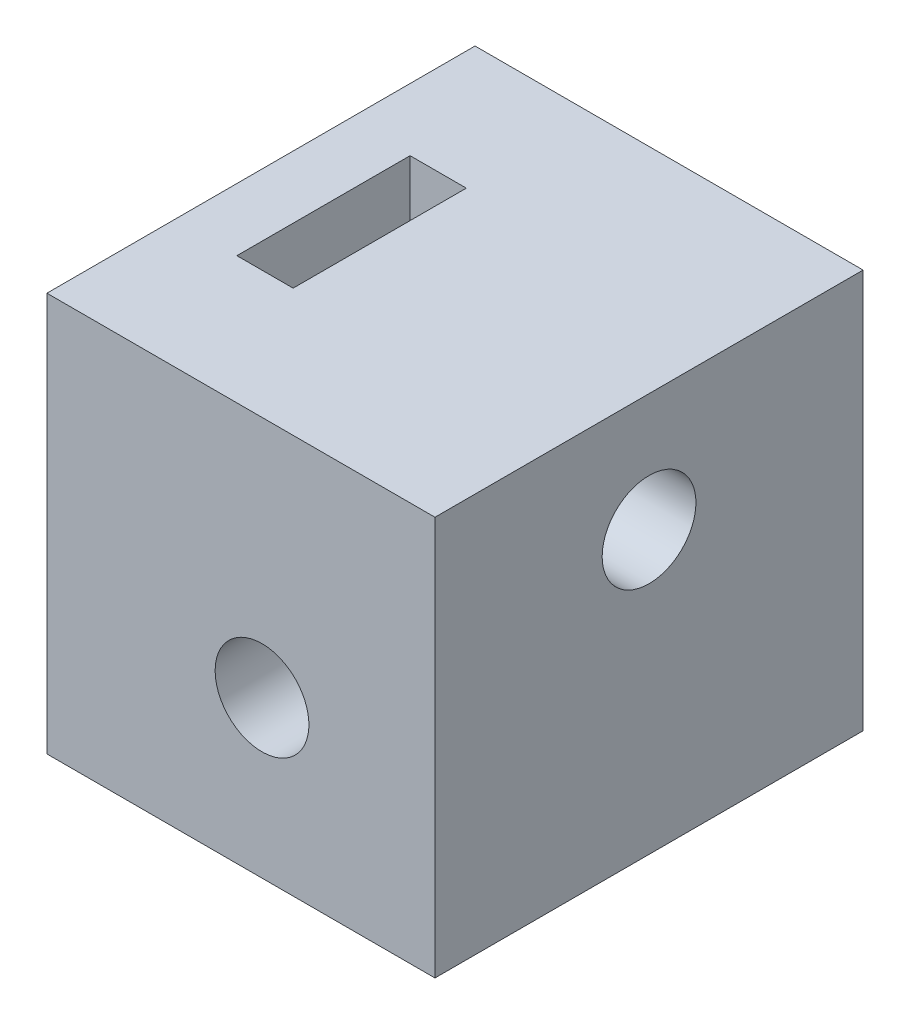
from build123d import *

# Parameters (mm, degrees)
SKETCH1_W           = 12.41763252
SKETCH1_H           = 12.769068876
SKETCH1_R           = 1.5
BOSS_EXTRUDE1_DEPTH = 13.7
SKETCH2_R           = 1.5
CUT_EXTRUDE1_DEPTH  = 23.47079699
CUT_EXTRUDE2_DEPTH  = 1.8
SKETCH5_W           = 1.8
SKETCH5_H           = 5.542562584
CUT_EXTRUDE4_DEPTH  = 3.769069
SKETCH6_W           = 1.8
SKETCH6_H           = 2.771281292
CUT_EXTRUDE5_DEPTH  = 17.740669043


with BuildPart() as part:
    # Sketch1 → Boss-Extrude1 (new body)
    # profile 1 of 2: a face of its own
    with BuildSketch(Plane.XY):
        with Locations((0.79118374, 6.384534438)):
            Rectangle(SKETCH1_W, SKETCH1_H)
        with Locations(Location((1.465537563, 5, 0), (0, 0, 180))):
            Circle(SKETCH1_R, mode=Mode.SUBTRACT)
        with Locations((1.465537563, 10)):
            Circle(SKETCH1_R, mode=Mode.SUBTRACT)
    # profile 2 of 2: a face of its own
    with BuildSketch(Plane.XY):
        with Locations((1.465537563, 10)):
            Circle(SKETCH1_R)
    extrude(amount=BOSS_EXTRUDE1_DEPTH)

    # Sketch2 → Cut-Extrude1 (cut, through all)
    with BuildSketch(Plane.ZY.offset(5.41763252)):
        with Locations((6.85, 9)):
            Circle(SKETCH2_R)
    extrude(amount=-CUT_EXTRUDE1_DEPTH, mode=Mode.SUBTRACT)

    # Sketch3 → Cut-Extrude2 (cut)
    with BuildSketch(Plane(origin=(-3.41763252, 0, 0), x_dir=(0, 0, -1), z_dir=(1, 0, 0))):
        Polygon((-5.464359354, 6.6), (-4.078718708, 9), (-5.464359354, 11.4), (-8.235640646, 11.4), (-9.621281292, 9), (-8.235640646, 6.6), align=None)
    extrude(amount=CUT_EXTRUDE2_DEPTH, mode=Mode.SUBTRACT)

    # Sketch5 → Cut-Extrude4 (cut)
    with BuildSketch(Plane(origin=(0, 12.769068876, 0), x_dir=(1, 0, 0), z_dir=(0, 1, 0))):
        with Locations((-2.51763252, -6.85)):
            Rectangle(SKETCH5_W, SKETCH5_H)
    extrude(amount=-CUT_EXTRUDE4_DEPTH, mode=Mode.SUBTRACT)

    # Sketch6 → Cut-Extrude5 (cut, through all)
    with BuildSketch(Plane(origin=(0, 6.6, 0), x_dir=(1, 0, 0), z_dir=(0, 1, 0))):
        with Locations((-2.51763252, -6.85)):
            Rectangle(SKETCH6_W, SKETCH6_H)
    extrude(amount=-CUT_EXTRUDE5_DEPTH, mode=Mode.SUBTRACT)


solid = part.part
